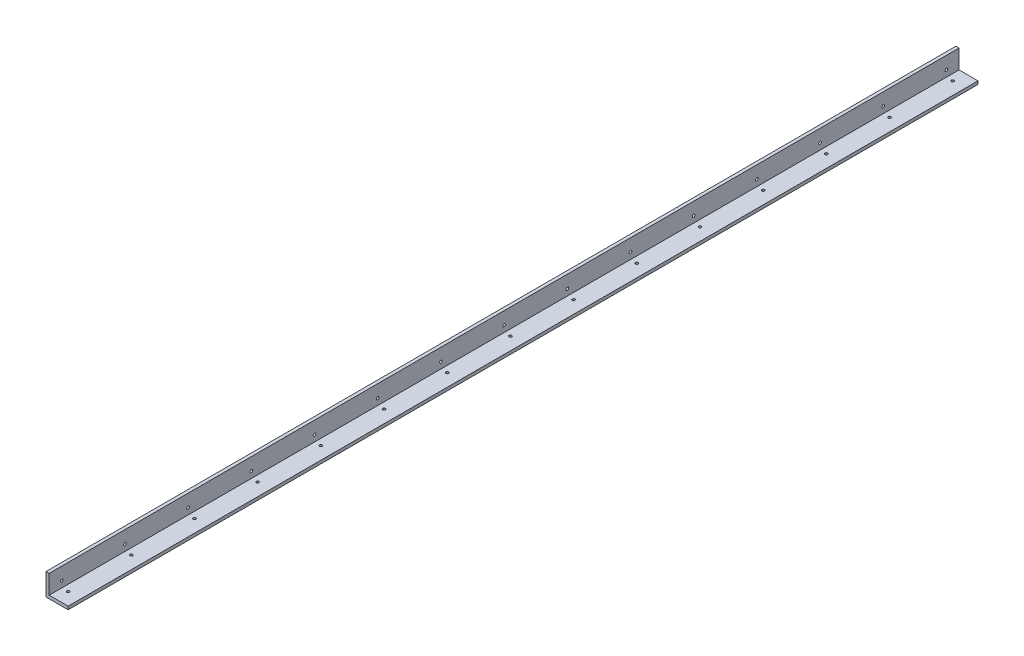
from build123d import *

# Parameters (mm, degrees)
AUFSATZ_LINEAR_AUSTRAGEN1_DEPTH      = 720
AUFSATZ_LINEAR_AUSTRAGEN1_DEPTH_BACK = 720
LINEARES_MUSTER1_COUNT               = 15
LINEARES_MUSTER1_PITCH               = 100
LINEARES_MUSTER2_COUNT               = 15
LINEARES_MUSTER2_PITCH               = 100


with BuildPart() as part:
    # Skizze1 → Aufsatz-Linear austragen1 (new, two sides: drawn at the far end of the back side and taken through both)
    with BuildSketch(Plane.XY.offset(-AUFSATZ_LINEAR_AUSTRAGEN1_DEPTH_BACK)):
        Polygon((0, 0), (0, 35), (5, 35), (5, 5), (35, 5), (35, 0), align=None)
    extrude(amount=AUFSATZ_LINEAR_AUSTRAGEN1_DEPTH + AUFSATZ_LINEAR_AUSTRAGEN1_DEPTH_BACK)

    # Skizze2 → M5 Gewindebohrung1 (revolve, cut)
    with BuildSketch(Plane(origin=(15, 0, 700), x_dir=(0, 0, -1), z_dir=(1, 0, 0))):
        Polygon((0, 0), (0, 15.2618073), (2.1, 14), (2.1, 0), align=None)
    m5_gewindebohrung1 = revolve(axis=Axis((15, -6.35, 700), (0, 1, 0)), mode=Mode.SUBTRACT)

    # Lineares Muster1: M5 Gewindebohrung1 ×15
    with Locations(*[(0, 0, -i * LINEARES_MUSTER1_PITCH) for i in range(1, LINEARES_MUSTER1_COUNT)]):
        add(m5_gewindebohrung1, mode=Mode.SUBTRACT)

    # Skizze4 → M5 Gewindebohrung2 (revolve, cut)
    with BuildSketch(Plane(origin=(0, 15, 700), x_dir=(0, 0, 1), z_dir=(0, 1, 0))):
        Polygon((0, 0), (0, 15.2618073), (2.1, 14), (2.1, 0), align=None)
    m5_gewindebohrung2 = revolve(axis=Axis((-6.35, 15, 700), (1, 0, 0)), mode=Mode.SUBTRACT)

    # Lineares Muster2: M5 Gewindebohrung2 ×15
    with Locations(*[(0, 0, -i * LINEARES_MUSTER2_PITCH) for i in range(1, LINEARES_MUSTER2_COUNT)]):
        add(m5_gewindebohrung2, mode=Mode.SUBTRACT)


solid = part.part
